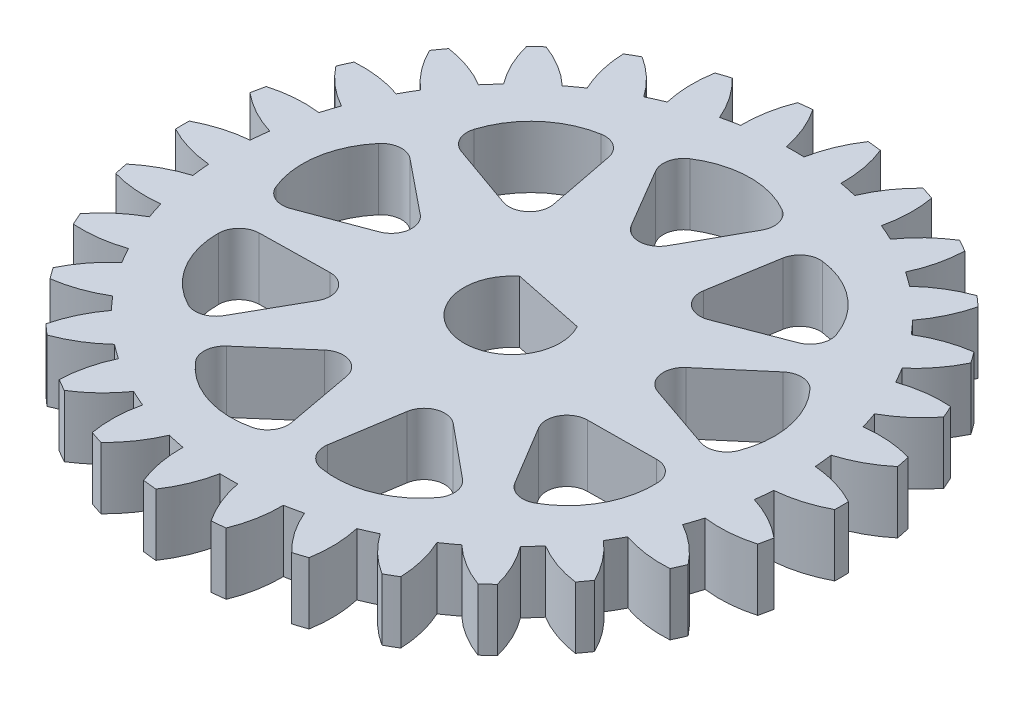
from build123d import *

# Parameters (mm, degrees)
SKETCH1_R           = 16
BOSS_EXTRUDE1_DEPTH = 3
CUT_EXTRUDE1_DEPTH  = 23.825424421
CIRPATTERN1_COUNT   = 30
CUT_EXTRUDE6_DEPTH  = 10
CUT_EXTRUDE7_DEPTH  = 10
CIRPATTERN3_COUNT   = 9
FILLET3_R           = 1


with BuildPart() as part:
    # Sketch1 → Boss-Extrude1 (new body)
    with BuildSketch(Plane(origin=(0, 0, 0), x_dir=(1, 0, 0), z_dir=(0, 1, 0))):
        Circle(SKETCH1_R)
    extrude(amount=BOSS_EXTRUDE1_DEPTH)

    # Sketch1<3> → Cut-Extrude1 (cut, through all)
    with BuildSketch(Plane(origin=(0, 0, 0), x_dir=(1, 0, 0), z_dir=(0, 1, 0))):
        with BuildLine():
            ThreePointArc((0.43100755, 13.743243158), (0.775178306, 14.889054262), (1.339840569, 15.943802158))
            ThreePointArc((1.339840569, 15.943802158), (0, 16), (-1.339840569, 15.943802158))
            ThreePointArc((-1.339840569, 15.943802158), (-0.775178306, 14.889054262), (-0.43100755, 13.743243158))
            ThreePointArc((-0.43100755, 13.743243158), (0, 13.75), (0.43100755, 13.743243158))
        make_face()
    cut_extrude1 = extrude(amount=CUT_EXTRUDE1_DEPTH, mode=Mode.SUBTRACT)

    # CirPattern1: Cut-Extrude1 ×30 about axis
    cirpattern1_axis = Axis((0, 3, 0), (0, -1, 0))
    for i in range(1, CIRPATTERN1_COUNT):
        add(cut_extrude1.rotate(cirpattern1_axis, i * 360 / CIRPATTERN1_COUNT), mode=Mode.SUBTRACT)

    # Sketch6 → Cut-Extrude6 (cut)
    with BuildSketch(Plane.XZ):
        with BuildLine():
            Line((2.056156645, -1.109609527), (-1.45356887, -1.82924875))
            ThreePointArc((-1.45356887, -1.82924875), (-0.46930604, 2.28883492), (2.056156645, -1.109609527))
        make_face()
    extrude(amount=-CUT_EXTRUDE6_DEPTH, mode=Mode.SUBTRACT)

    # Sketch8 → Cut-Extrude7 (cut)
    with BuildSketch(Plane(origin=(0, 0, 0), x_dir=(-1, 0, 0), z_dir=(0, -1, 0))):
        with BuildLine():
            Line((-2.897675733, 10.397542336), (0, 5.170362582))
            Line((0, 5.170362582), (3.011310075, 10.283907993))
            ThreePointArc((3.011310075, 10.283907993), (0.080351614, 11.564516196), (-2.897675733, 10.397542336))
        make_face()
    cut_extrude7 = extrude(amount=-CUT_EXTRUDE7_DEPTH, mode=Mode.SUBTRACT)

    # CirPattern3: Cut-Extrude7 ×9 about axis
    cirpattern3_axis = Axis((0, 0, 0), (0, 1, 0))
    for i in range(1, CIRPATTERN3_COUNT):
        add(cut_extrude7.rotate(cirpattern3_axis, i * 360 / CIRPATTERN3_COUNT), mode=Mode.SUBTRACT)

    # Fillet3
    fillet3_edges = [part.edges().sort_by_distance(p)[0] for p in [
        (4.477665343, 1.5, 2.585181291),
        (7.555697933, 1.5, 7.708231965),
        (10.41178061, 1.5, 2.534082973),
        (6.347009543, 1.5, 8.633783751),
        (0.833244416, 1.5, 10.761557277),
        (1.768368151, 1.5, 4.858551565),
        (-1.768368151, 1.5, 4.858551565),
        (-6.279093424, 1.5, 8.779430338),
        (-0.687597829, 1.5, 10.693641158),
        (-7.400470535, 1.5, 7.749825021),
        (-10.453373666, 1.5, 2.689310371),
        (-4.477665343, 1.5, 2.585181291),
        (-5.091813157, 1.5, -0.89782404),
        (-9.736404194, 1.5, -4.659167806),
        (-10.65058083, 1.5, 1.179779627),
        (-8.917165987, 1.5, -5.942297767),
        (-4.463662992, 1.5, -9.827569587),
        (-3.323445006, 1.5, -3.960727525),
        (0, 1.5, -5.170362582),
        (3.323445006, 1.5, -3.960727525),
        (5.091813157, 1.5, -0.89782404),
        (9.604763816, 1.5, -4.751343391),
        (10.742756415, 1.5, 1.048139249),
        (4.303571288, 1.5, -9.813563377),
        (8.903159778, 1.5, -6.10238947),
        (2.897675733, 1.5, -10.397542336),
        (-3.011310075, 1.5, -10.283907993),
    ]]
    fillet(fillet3_edges, radius=FILLET3_R)


solid = part.part
